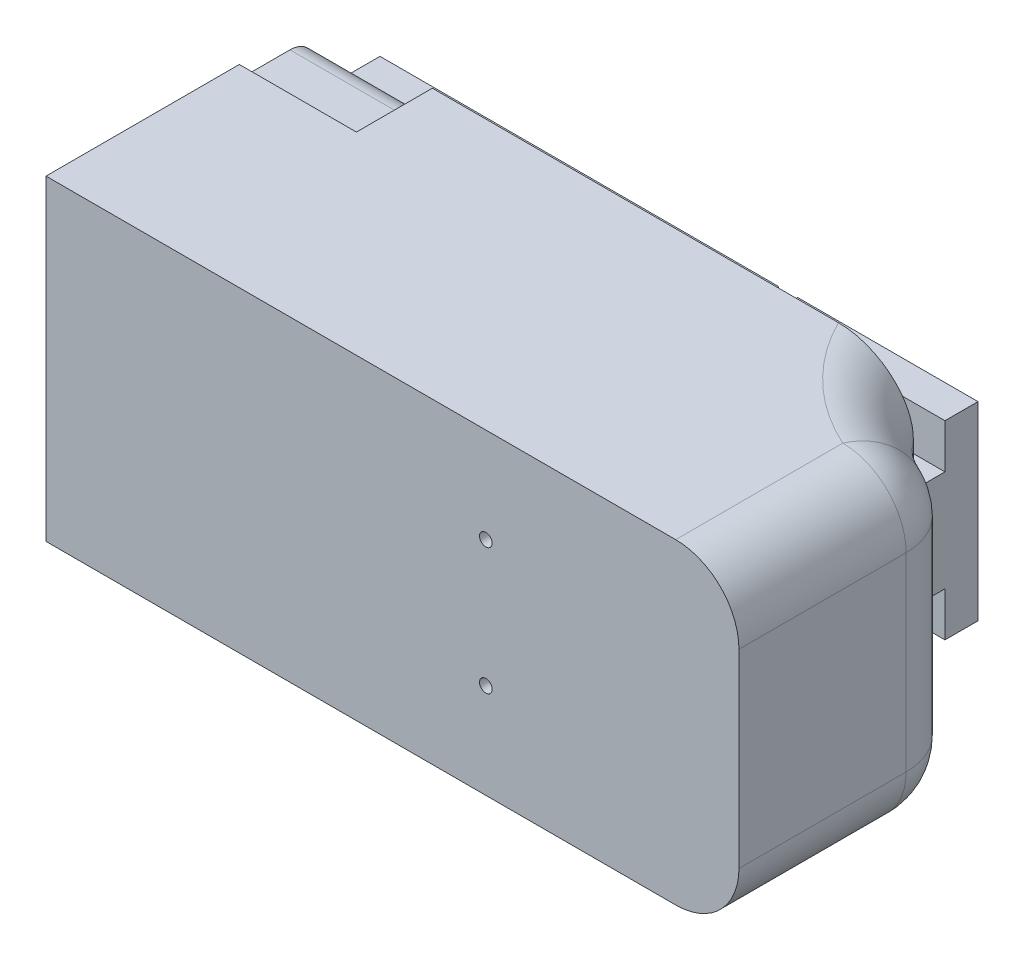
from build123d import *

# Parameters (mm, degrees)
SKETCH1_W           = 109.5
SKETCH1_H           = 50
BOSS_EXTRUDE1_DEPTH = 52.55
SKETCH2_W           = 109.5
SKETCH2_H           = 10
CUT_EXTRUDE1_DEPTH  = 10
SKETCH3_W           = 18.5
SKETCH3_H           = 12
CUT_EXTRUDE2_DEPTH  = 2
FILLET1_R           = 4
SKETCH4_W           = 91
SKETCH4_H           = 5
CUT_EXTRUDE3_DEPTH  = 7
SKETCH5_W           = 23.393715289
SKETCH5_H           = 10
CUT_EXTRUDE4_DEPTH  = 128.873971159
SKETCH6_W           = 94.5
SKETCH6_H           = 10
CUT_EXTRUDE5_DEPTH  = 10
SKETCH8_W           = 18.5
SKETCH8_H           = 12
CUT_EXTRUDE6_DEPTH  = 2
FILLET2_R           = 4
SKETCH9_W           = 76
SKETCH9_H           = 5
CUT_EXTRUDE7_DEPTH  = 7
SKETCH10_R          = 1.5
CUT_EXTRUDE8_DEPTH  = 128.873971159
SKETCH11_R          = 1
CUT_EXTRUDE9_DEPTH  = 7.55
CUT_EXTRUDE10_DEPTH = 132.34592685
FILLET3_R           = 10
SKETCH13_R          = 2.5
CUT_EXTRUDE11_DEPTH = 8
FILLET4_R           = 10
FILLET5_R           = 10
SKETCH15_W          = 63
SKETCH15_H          = 30
SKETCH15_W_2        = 28.5
BOSS_EXTRUDE2_DEPTH = 0.222


with BuildPart() as part:
    # Sketch1 → Boss-Extrude1 (new body)
    with BuildSketch(Plane.XY):
        with Locations((54.75, 25)):
            Rectangle(SKETCH1_W, SKETCH1_H)
    extrude(amount=BOSS_EXTRUDE1_DEPTH)

    # Sketch2 → Cut-Extrude1 (cut)
    with BuildSketch(Plane.XZ):
        with Locations((54.75, 5)):
            Rectangle(SKETCH2_W, SKETCH2_H)
    extrude(amount=-CUT_EXTRUDE1_DEPTH, mode=Mode.SUBTRACT)

    # Sketch3 → Cut-Extrude2 (cut)
    with BuildSketch(Plane.XZ):
        with Locations((9.25, 16)):
            Rectangle(SKETCH3_W, SKETCH3_H)
    extrude(amount=-CUT_EXTRUDE2_DEPTH, mode=Mode.SUBTRACT)

    # Fillet1
    fillet1_edges = [part.edges().sort_by_distance(p)[0] for p in [
        (9.25, 2, 10),
    ]]
    fillet(fillet1_edges, radius=FILLET1_R)

    # Sketch4 → Cut-Extrude3 (cut)
    with BuildSketch(Plane.XZ.offset(-10)):
        with Locations((64, 7.5)):
            Rectangle(SKETCH4_W, SKETCH4_H)
    extrude(amount=-CUT_EXTRUDE3_DEPTH, mode=Mode.SUBTRACT)

    # Sketch5 → Cut-Extrude4 (cut, through all)
    with BuildSketch(Plane.XZ.offset(-10)):
        with Locations((106.196857644, 5)):
            Rectangle(SKETCH5_W, SKETCH5_H)
    extrude(amount=-CUT_EXTRUDE4_DEPTH, mode=Mode.SUBTRACT)

    # Sketch6 → Cut-Extrude5 (cut)
    with BuildSketch(Plane(origin=(0, 50, 0), x_dir=(1, 0, 0), z_dir=(0, 1, 0))):
        with Locations((47.25, -5)):
            Rectangle(SKETCH6_W, SKETCH6_H)
    extrude(amount=-CUT_EXTRUDE5_DEPTH, mode=Mode.SUBTRACT)

    # Sketch8 → Cut-Extrude6 (cut)
    with BuildSketch(Plane(origin=(0, 50, 0), x_dir=(1, 0, 0), z_dir=(0, 1, 0))):
        with Locations((9.25, -16)):
            Rectangle(SKETCH8_W, SKETCH8_H)
    extrude(amount=-CUT_EXTRUDE6_DEPTH, mode=Mode.SUBTRACT)

    # Fillet2
    fillet2_edges = [part.edges().sort_by_distance(p)[0] for p in [
        (9.25, 48, 10),
    ]]
    fillet(fillet2_edges, radius=FILLET2_R)

    # Sketch9 → Cut-Extrude7 (cut)
    with BuildSketch(Plane(origin=(0, 40, 0), x_dir=(1, 0, 0), z_dir=(0, 1, 0))):
        with Locations((56.5, -7.5)):
            Rectangle(SKETCH9_W, SKETCH9_H)
    extrude(amount=-CUT_EXTRUDE7_DEPTH, mode=Mode.SUBTRACT)

    # Sketch10 → Cut-Extrude8 (cut, through all)
    with BuildSketch(Plane(origin=(0, 40, 0), x_dir=(1, 0, 0), z_dir=(0, 1, 0))):
        with Locations((64.5, 0)):
            Circle(SKETCH10_R)
    extrude(amount=-CUT_EXTRUDE8_DEPTH, mode=Mode.SUBTRACT)

    # Sketch11 → Cut-Extrude9 (cut)
    with BuildSketch(Plane.XY.offset(52.55)):
        with Locations((69.5, 15)):
            Circle(SKETCH11_R)
        with Locations((69.5, 35)):
            Circle(SKETCH11_R)
    extrude(amount=-CUT_EXTRUDE9_DEPTH, mode=Mode.SUBTRACT)

    # Sketch12 → Cut-Extrude10 (cut, through all)
    with BuildSketch(Plane(origin=(0, 50, 0), x_dir=(1, 0, 0), z_dir=(0, 1, 0))):
        with BuildLine():
            Line((94.5, -10), (109.5, -10))
            Line((109.5, -10), (109.5, -18.85))
            ThreePointArc((109.5, -18.85), (101.204423403, -15.77343491), (94.5, -10))
        make_face()
    extrude(amount=-CUT_EXTRUDE10_DEPTH, mode=Mode.SUBTRACT)

    # Fillet3
    fillet3_edges = [part.edges().sort_by_distance(p)[0] for p in [
        (109.5, 25, 18.85),
    ]]
    fillet(fillet3_edges, radius=FILLET3_R)

    # Sketch13 → Cut-Extrude11 (cut)
    with BuildSketch(Plane.ZY):
        with Locations((37.552, 35)):
            Circle(SKETCH13_R)
        with Locations((37.552, 15)):
            Circle(SKETCH13_R)
    extrude(amount=-CUT_EXTRUDE11_DEPTH, mode=Mode.SUBTRACT)

    # Fillet4
    fillet4_edges = [part.edges().sort_by_distance(p)[0] for p in [
        (98.648531421, 50, 14.04433448),
        (107.901372758, 50, 20.714757596),
        (109.5, 50, 39.344247885),
    ]]
    fillet(fillet4_edges, radius=FILLET4_R)

    # Fillet5
    fillet5_edges = [part.edges().sort_by_distance(p)[0] for p in [
        (98.648531421, 0, 14.04433448),
        (107.901372758, 0, 20.714757596),
        (109.5, 0, 39.344247885),
    ]]
    fillet(fillet5_edges, radius=FILLET5_R)

    # Sketch15 → Boss-Extrude2 (add)
    with BuildSketch(Plane(origin=(0, 0, 0), x_dir=(-1, 0, 0), z_dir=(0, 0, -1))):
        with Locations((-31.5, 25)):
            Rectangle(SKETCH15_W, SKETCH15_H)
        with Locations((-80.25, 25)):
            Rectangle(SKETCH15_W_2, SKETCH15_H)
    extrude(amount=BOSS_EXTRUDE2_DEPTH)


solid = part.part
